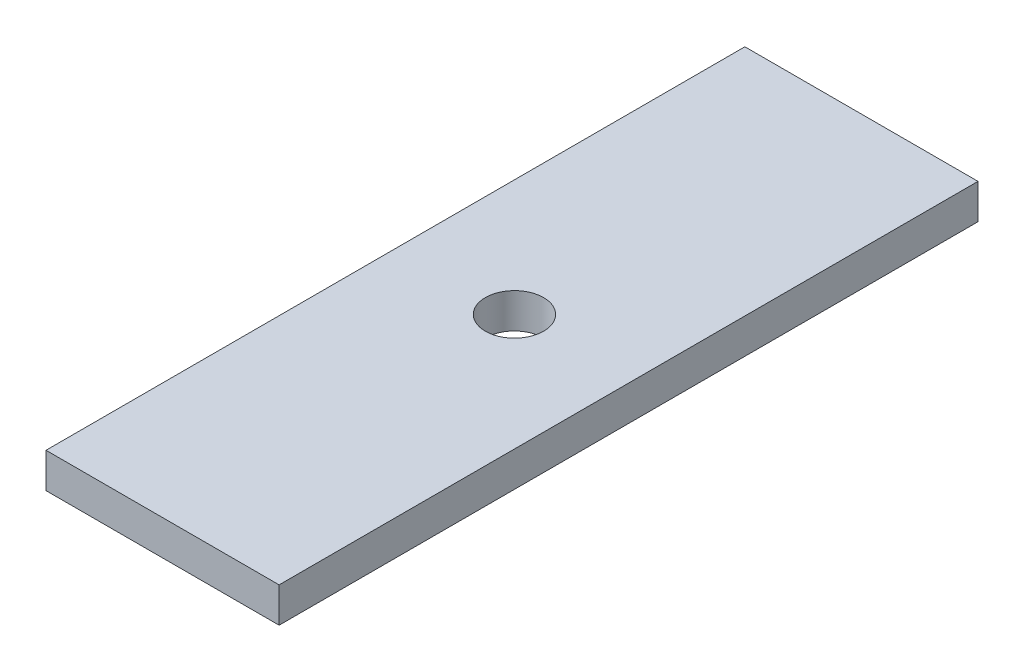
from build123d import *

# Parameters (mm, degrees)
SKETCH1_W           = 20
SKETCH1_H           = 59.958662332
SKETCH1_R           = 2.5
BOSS_EXTRUDE1_DEPTH = 3


with BuildPart() as part:
    # Sketch1 → Boss-Extrude1 (new body)
    with BuildSketch(Plane(origin=(0, 0, 0), x_dir=(1, 0, 0), z_dir=(0, 1, 0))):
        Rectangle(SKETCH1_W, SKETCH1_H)
        with Locations(Location((0, 0.21, 0), (0, 0, 270))):
            Circle(SKETCH1_R, mode=Mode.SUBTRACT)
    extrude(amount=BOSS_EXTRUDE1_DEPTH)


solid = part.part
